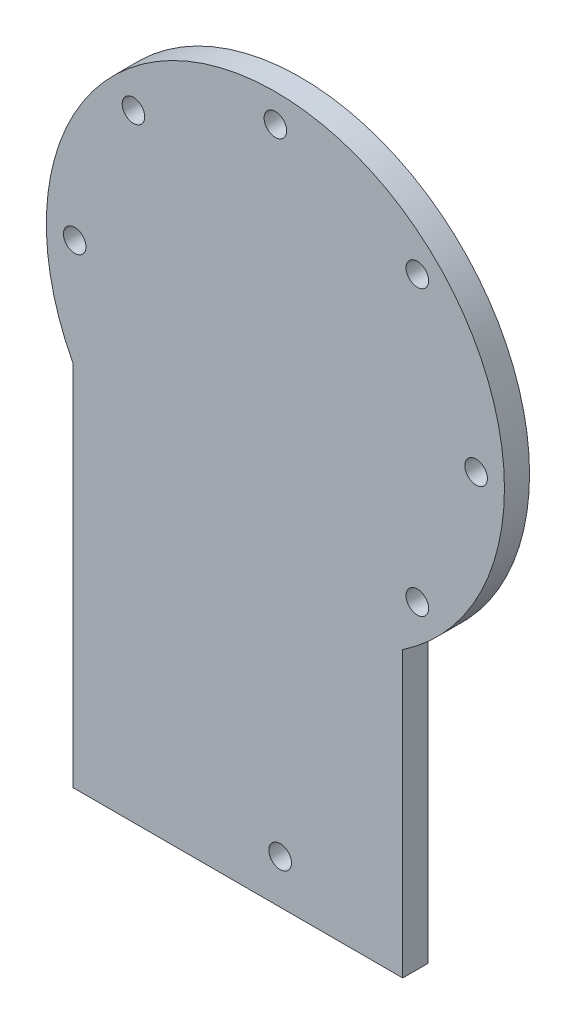
from build123d import *

# Parameters (mm, degrees)
BOSS_EXTRU_1_DEPTH      = 2
ESQUISSE2_R             = 0.9
ENL_V_MAT_EXTRU_1_DEPTH = 51.356664533
ESQUISSE3_R             = 0.9
ENL_V_MAT_EXTRU_2_DEPTH = 51.356664533


with BuildPart() as part:
    # Esquisse1 → Boss.-Extru.1 (new body)
    with BuildSketch(Plane.XY):
        with BuildLine():
            Line((-22.3, -14.668472775), (-22.3, -44))
            Line((-22.3, -44), (4, -44))
            Line((4, -44), (4, -21.327759335))
            ThreePointArc((4, -21.327759335), (-1.668200766, 11.550292485), (-22.3, -14.668472775))
        make_face()
    extrude(amount=BOSS_EXTRU_1_DEPTH)

    # Esquisse2 → Enlèv. mat.-Extru.1 (cut, through all)
    with BuildSketch(Plane.XY.offset(2)):
        with Locations((9.85, -6.15)):
            Circle(ESQUISSE2_R)
        with Locations((5.163708499, -17.463708499)):
            Circle(ESQUISSE2_R)
        with Locations((-22.15, -6.15)):
            Circle(ESQUISSE2_R)
        with Locations((-17.463708499, 5.163708499)):
            Circle(ESQUISSE2_R)
        with Locations((-6.15, 9.85)):
            Circle(ESQUISSE2_R)
        with Locations((5.163708499, 5.163708499)):
            Circle(ESQUISSE2_R)
    extrude(amount=-ENL_V_MAT_EXTRU_1_DEPTH, mode=Mode.SUBTRACT)

    # Esquisse3 → Enlèv. mat.-Extru.2 (cut, through all)
    with BuildSketch(Plane(origin=(0, 0, 0), x_dir=(-1, 0, 0), z_dir=(0, 0, -1))):
        with Locations((5.77, -40.5)):
            Circle(ESQUISSE3_R)
    extrude(amount=-ENL_V_MAT_EXTRU_2_DEPTH, mode=Mode.SUBTRACT)


solid = part.part
